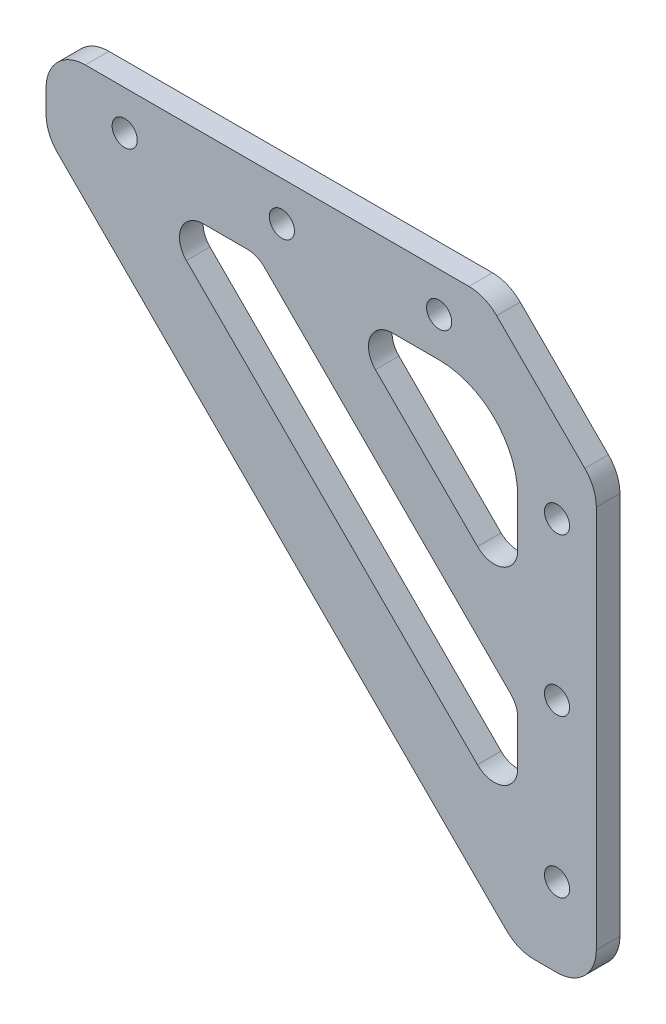
from build123d import *

# Parameters (mm, degrees)
SKETCH_1_R               = 1.6
EXTRUDE_1_DEPTH          = 3
EXTRUDE_2_DEPTH          = 3
CUT_EXTRUDE_1_DEPTH      = 100.040395799
CUT_EXTRUDE_1_DEPTH_BACK = 3
FILLET_1_R               = 5
EXTRUDE_3_DEPTH          = 3
FILLET_2_R               = 3
FILLET_3_R               = 10


with BuildPart() as part:
    # 草图1 → 凸台-拉伸1 (new body)
    with BuildSketch(Plane.XY):
        Polygon((0, 0), (-70, 0), (-70, -10), (-10, -10), (-10, -70), (0, -70), align=None)
        with Locations((-20, -5)):
            Circle(SKETCH_1_R, mode=Mode.SUBTRACT)
        with Locations(Location((-5, -20, 0), (0, 0, 180))):
            Circle(SKETCH_1_R, mode=Mode.SUBTRACT)
        with Locations((-40, -5)):
            Circle(SKETCH_1_R, mode=Mode.SUBTRACT)
        with Locations((-60, -5)):
            Circle(SKETCH_1_R, mode=Mode.SUBTRACT)
        with Locations(Location((-5, -60, 0), (0, 0, 180))):
            Circle(SKETCH_1_R, mode=Mode.SUBTRACT)
        with Locations(Location((-5, -40, 0), (0, 0, 180))):
            Circle(SKETCH_1_R, mode=Mode.SUBTRACT)
    extrude(amount=EXTRUDE_1_DEPTH)

    # 草图2 → 凸台-拉伸2 (add)
    with BuildSketch(Plane.XY.offset(3)):
        Polygon((-70, -10), (-10, -70), (-10, -57.272077939), (-57.272077939, -10), align=None)
    extrude(amount=-EXTRUDE_2_DEPTH)

    # 草图3 → 切除-拉伸1 (cut, two sides: drawn at the far end of the back side and taken through both)
    with BuildSketch(Plane.XY.offset(3).offset(-CUT_EXTRUDE_1_DEPTH_BACK)):
        Polygon((-147.863122604, 133.72098698), (-14.142135624, 0), (0, -14.142135624), (133.72098698, -147.863122604), (401.162960941, 119.578851357), (119.578851357, 401.162960941), align=None)
    extrude(amount=CUT_EXTRUDE_1_DEPTH + CUT_EXTRUDE_1_DEPTH_BACK, mode=Mode.SUBTRACT)

    # 圆角1
    fillet_1_edges = [part.edges().sort_by_distance(p)[0] for p in [
        (0, -70, 1.5),
        (-10, -70, 1.5),
        (-70, -10, 1.5),
        (-70, 0, 1.5),
        (-14.142135624, 0, 1.5),
        (0, -14.142135624, 1.5),
    ]]
    fillet(fillet_1_edges, radius=FILLET_1_R)

    # 草图4 → 凸台-拉伸3 (add, through all)
    with BuildSketch(Plane.XY.offset(3)):
        Polygon((-43.129942315, -10), (-10, -43.129942315), (-10, -33.230447378), (-33.230447378, -10), align=None)
    extrude(amount=-EXTRUDE_3_DEPTH)

    # 圆角2
    fillet_2_edges = [part.edges().sort_by_distance(p)[0] for p in [
        (-43.129942315, -10, 1.5),
        (-33.230447378, -10, 1.5),
        (-10, -33.230447378, 1.5),
        (-10, -43.129942315, 1.5),
        (-57.272077939, -10, 1.5),
        (-10, -57.272077939, 1.5),
    ]]
    fillet(fillet_2_edges, radius=FILLET_2_R)

    # 圆角3
    fillet_3_edges = [part.edges().sort_by_distance(p)[0] for p in [
        (-10, -10, 1.5),
    ]]
    fillet(fillet_3_edges, radius=FILLET_3_R)


solid = part.part
